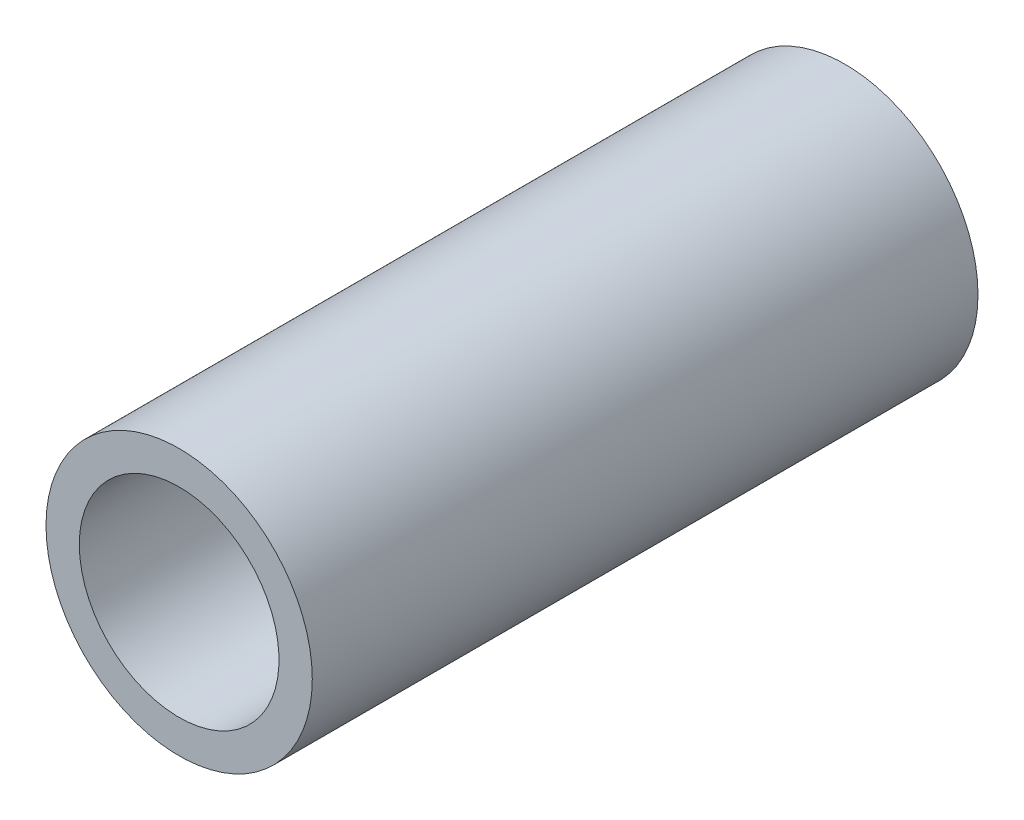
from build123d import *

# Parameters (mm, degrees)
SKETCH1_R           = 12
SKETCH1_R_2         = 9
BOSS_EXTRUDE1_DEPTH = 60


with BuildPart() as part:
    # Sketch1 → Boss-Extrude1 (new body)
    with BuildSketch(Plane.XY):
        with Locations(Location((0, 0, 0), (0, 0, 180))):
            Circle(SKETCH1_R)
        with Locations(Location((0, 0, 0), (0, 0, 180))):
            Circle(SKETCH1_R_2, mode=Mode.SUBTRACT)
    extrude(amount=BOSS_EXTRUDE1_DEPTH)


solid = part.part
